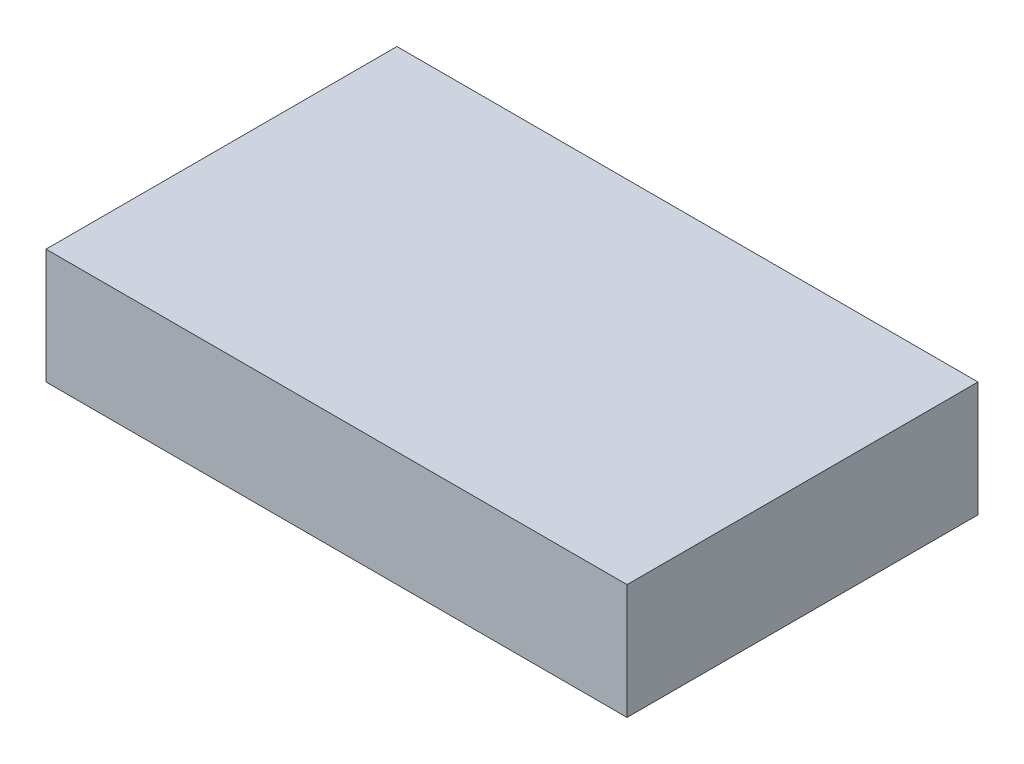
from build123d import *

# Parameters (mm, degrees)
SKETCH1_W           = 10.1
SKETCH1_H           = 6.1
BOSS_EXTRUDE1_DEPTH = 2


with BuildPart() as part:
    # Sketch1 → Boss-Extrude1 (new body)
    with BuildSketch(Plane(origin=(0, 0, 0), x_dir=(1, 0, 0), z_dir=(0, 1, 0))):
        Rectangle(SKETCH1_W, SKETCH1_H)
    extrude(amount=BOSS_EXTRUDE1_DEPTH)


solid = part.part
